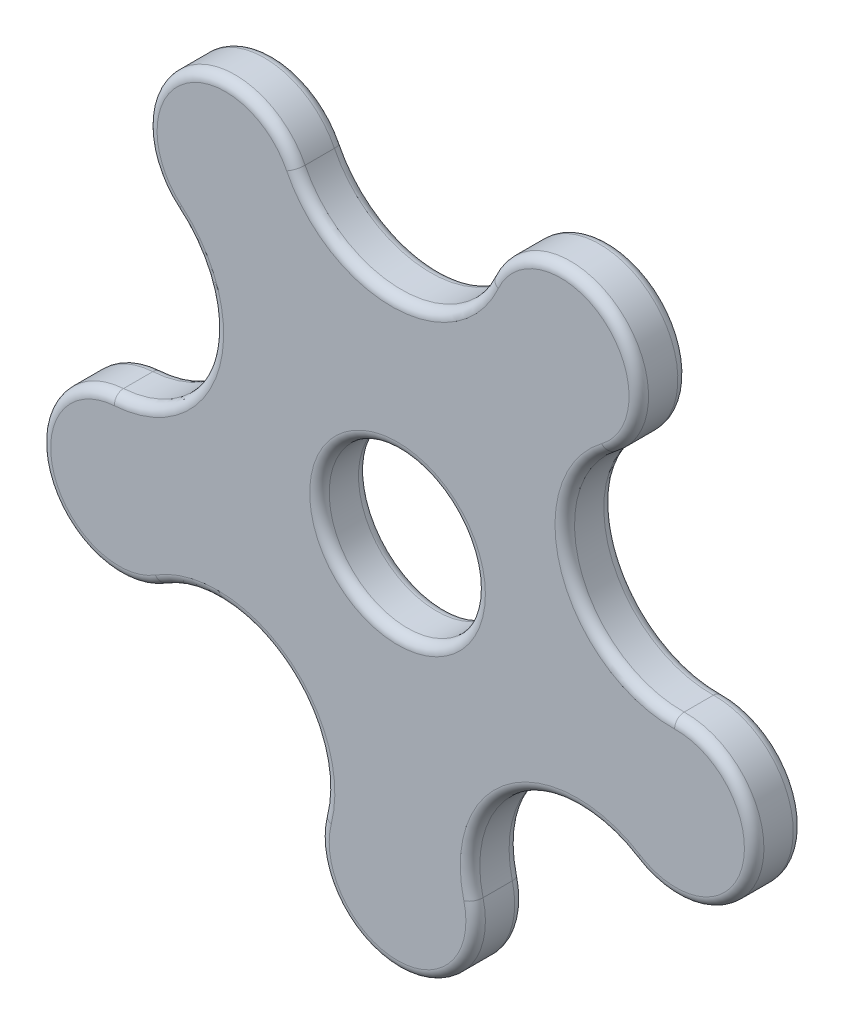
from build123d import *

# Parameters (mm, degrees)
SKETCH_1_R      = 8
EXTRUDE_1_DEPTH = 5
FILLET_1_R      = 1
FILLET_2_R      = 1
FILLET_3_R      = 1
FILLET_4_R      = 1


with BuildPart() as part:
    # 草图1 → 凸台-拉伸1 (new body)
    with BuildSketch(Plane.XY):
        with BuildLine():
            ThreePointArc((24.276039458, -16.044680758), (36.242292676, -11.402806952), (28.361202656, -1.272326775))
            ThreePointArc((28.361202656, -1.272326775), (17.73067017, 6.130595097), (21.51820106, 18.518737933))
            ThreePointArc((21.51820106, 18.518737933), (21.709189903, 31.161275695), (9.417249685, 28.19843188))
            ThreePointArc((9.417249685, 28.19843188), (-0.406909008, 21.716378544), (-10.46700049, 27.82585224))
            ThreePointArc((-10.46700049, 27.82585224), (-22.587617913, 30.552013322), (-22.761106936, 18.129806493))
            ThreePointArc((-22.761106936, 18.129806493), (-19.349865636, 6.287152465), (-29.070555205, -1.288678575))
            ThreePointArc((-29.070555205, -1.288678575), (-36.140147619, -11.742645786), (-24.276039458, -16.044680758))
            ThreePointArc((-24.276039458, -16.044680758), (-11.958874641, -16.459978845), (-7.757689438, -28.04596454))
            ThreePointArc((-7.757689438, -28.04596454), (0, -38), (7.757689438, -28.04596454))
            ThreePointArc((7.757689438, -28.04596454), (11.958874641, -16.459978845), (24.276039458, -16.044680758))
        make_face()
        Circle(SKETCH_1_R, mode=Mode.SUBTRACT)
    extrude(amount=EXTRUDE_1_DEPTH)

    # 圆角1
    fillet_1_edges = [part.edges().sort_by_distance(p)[0] for p in [
        (-19.349865636, 6.287152465, 5),
        (-36.140147619, -11.742645786, 5),
        (-11.958874641, -16.459978845, 5),
        (0, -38, 5),
        (11.958874641, -16.459978845, 5),
        (36.242292676, -11.402806952, 5),
        (17.73067017, 6.130595097, 5),
        (21.709189903, 31.161275695, 5),
        (-0.406909008, 21.716378544, 5),
        (-22.587617913, 30.552013322, 5),
    ]]
    fillet(fillet_1_edges, radius=FILLET_1_R)

    # 圆角2
    fillet_2_edges = [part.edges().sort_by_distance(p)[0] for p in [
        (21.709189903, 31.161275695, 0),
        (17.73067017, 6.130595097, 0),
        (36.242292676, -11.402806952, 0),
        (11.958874641, -16.459978845, 0),
        (0, -38, 0),
        (-11.958874641, -16.459978845, 0),
        (-36.140147619, -11.742645786, 0),
        (-19.349865636, 6.287152465, 0),
        (-22.587617913, 30.552013322, 0),
        (-0.406909008, 21.716378544, 0),
    ]]
    fillet(fillet_2_edges, radius=FILLET_2_R)

    # 圆角3
    fillet_3_edges = [part.edges().sort_by_distance(p)[0] for p in [
        (-8, 0, 5),
    ]]
    fillet(fillet_3_edges, radius=FILLET_3_R)

    # 圆角4
    fillet_4_edges = [part.edges().sort_by_distance(p)[0] for p in [
        (-8, 0, 0),
    ]]
    fillet(fillet_4_edges, radius=FILLET_4_R)


solid = part.part
